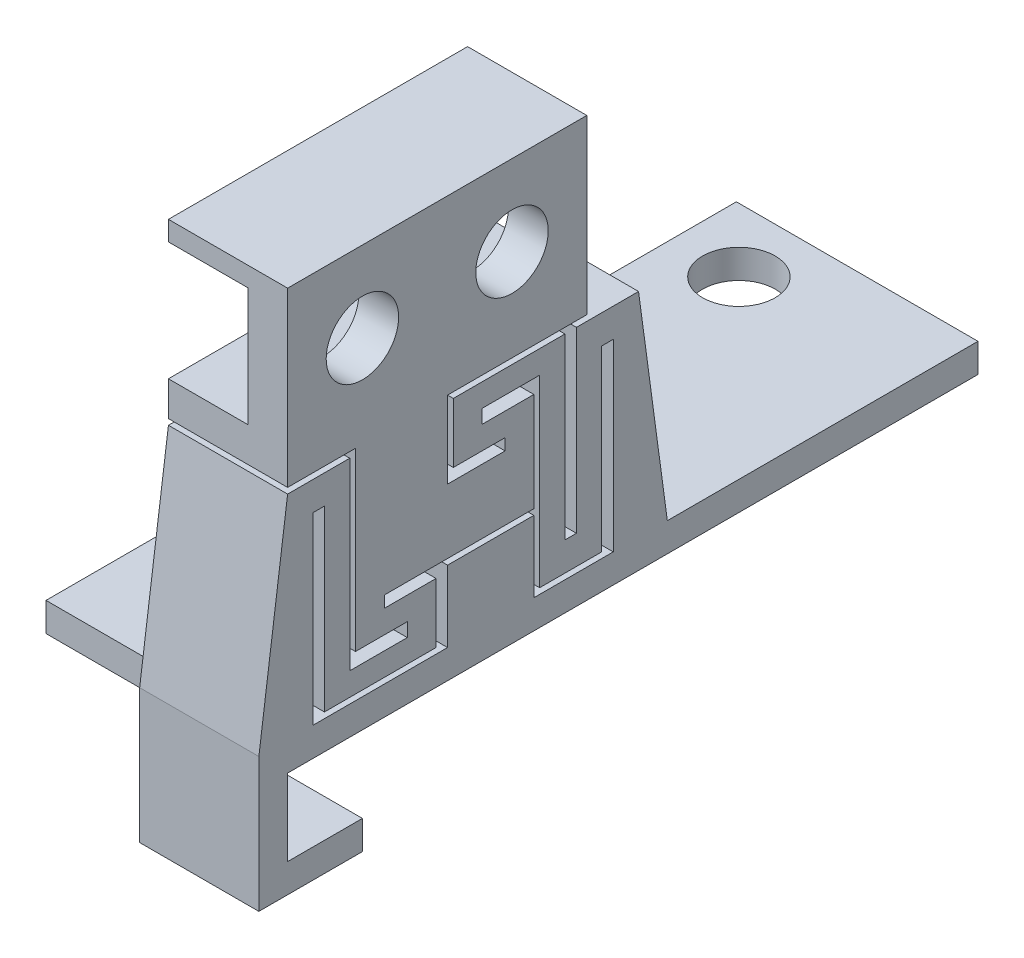
from build123d import *

# Parameters (mm, degrees)
BOSS_EXTRUDE1_DEPTH = 5.18
CUT_EXTRUDE1_REACH  = 30.641
SKETCH2_W           = 3.45
SKETCH2_H           = 5.15
SKETCH3_W           = 10.5
SKETCH3_H           = 30
SKETCH3_R           = 1.575
BOSS_EXTRUDE2_DEPTH = 1.25
CUT_EXTRUDE3_REACH  = 41.134
SKETCH7_R           = 1.575
SKETCH8_W           = 3.75
SKETCH8_H           = 3.1
BOSS_EXTRUDE3_DEPTH = 5.18


with BuildPart() as part:
    # Sketch1 → Boss-Extrude1 (new body)
    with BuildSketch(Plane(origin=(0, 0, 0), x_dir=(0, 0, -1), z_dir=(1, 0, 0))):
        Polygon((0, 0), (13, 0), (13, -7.5), (6.95, -7.5), (6.95, -10.85), (9.45, -10.85), (9.45, -10.35), (7.2, -10.35), (7.2, -7.75), (12.05, -7.75), (12.05, -15.5), (12.55, -15.5), (12.55, -7.75), (15.25, -7.75), (16.5, -17), (16.5, -18.25), (0, -18.25), (0, -21.58), (3.25, -21.58), (3.25, -22.83), (-1.25, -22.83), (-1.25, -17), (0, -7.75), (2.7, -7.75), (2.7, -15.75), (5.2, -15.75), (5.2, -15.15), (2.95, -15.15), (2.95, -7.5), (0, -7.5), align=None)
        Polygon((10.7, -9.35), (10.7, -13.65), (4.2, -13.65), (4.2, -14.15), (6.45, -14.15), (6.45, -16.75), (1.6, -16.75), (1.6, -9), (1.1, -9), (1.1, -17), (14.15, -17), (14.15, -9), (13.65, -9), (13.65, -16.75), (10.95, -16.75), (10.95, -8.75), (8.45, -8.75), (8.45, -9.35), align=None, mode=Mode.SUBTRACT)
    extrude(amount=BOSS_EXTRUDE1_DEPTH)

    # Sketch2 → Cut-Extrude1 (cut, up to next)
    with BuildSketch(Plane.XY, mode=Mode.PRIVATE) as cut_extrude1_sk1:
        with Locations((3.455, -3.425)):
            Rectangle(SKETCH2_W, SKETCH2_H)
    cut_extrude1_tool1 = extrude(cut_extrude1_sk1.sketch, amount=-CUT_EXTRUDE1_REACH, mode=Mode.PRIVATE) & part.part
    add(cut_extrude1_tool1.solids().sort_by_distance((3.455, -3.425, 0))[0], mode=Mode.SUBTRACT)

    # Sketch3 → Boss-Extrude2 (add)
    with BuildSketch(Plane.XZ.offset(18.25)):
        with Locations((5.25, -15)):
            Rectangle(SKETCH3_W, SKETCH3_H)
        with Locations(Location((7.62, -15.23, 0), (0, 0, 270))):
            Circle(SKETCH3_R, mode=Mode.SUBTRACT)
        with Locations(Location((7.62, -27.23, 0), (0, 0, 270))):
            Circle(SKETCH3_R, mode=Mode.SUBTRACT)
    extrude(amount=-BOSS_EXTRUDE2_DEPTH)

    # Sketch7 → Cut-Extrude3 (cut, up to next)
    with BuildSketch(Plane.ZY, mode=Mode.PRIVATE) as cut_extrude3_sk1:
        with Locations((-3.25, -3.5)):
            Circle(SKETCH7_R)
    cut_extrude3_tool1 = extrude(cut_extrude3_sk1.sketch, amount=-CUT_EXTRUDE3_REACH, mode=Mode.PRIVATE) & part.part
    # Sketch7 → Cut-Extrude3 (cut, up to next)
    with BuildSketch(Plane.ZY, mode=Mode.PRIVATE) as cut_extrude3_sk2:
        with Locations((-9.75, -3.5)):
            Circle(SKETCH7_R)
    cut_extrude3_tool2 = extrude(cut_extrude3_sk2.sketch, amount=-CUT_EXTRUDE3_REACH, mode=Mode.PRIVATE) & part.part
    add(cut_extrude3_tool1.solids().sort_by_distance((0, -3.5, -3.25))[0], mode=Mode.SUBTRACT)
    add(cut_extrude3_tool2.solids().sort_by_distance((0, -3.5, -9.75))[0], mode=Mode.SUBTRACT)

    # Sketch8 → Boss-Extrude3 (add)
    with BuildSketch(Plane.ZY):
        with Locations((-8.825, -15.45)):
            Rectangle(SKETCH8_W, SKETCH8_H)
    extrude(amount=-BOSS_EXTRUDE3_DEPTH)


with BuildPart() as body_2:
    # Mirror3: mirrored copy
    add(part.part.mirror(Plane(origin=(0, 0, 0), x_dir=(0, 0, 1), z_dir=(1, 0, 0))))


solid = body_2.part
